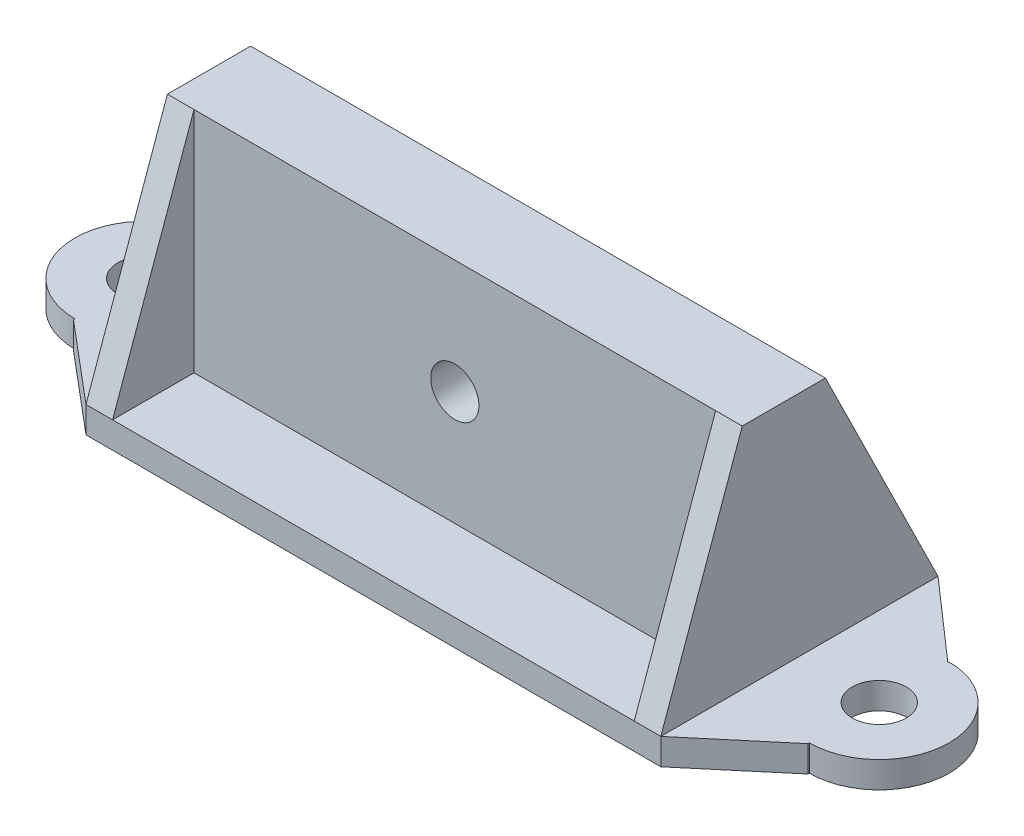
from build123d import *

# Parameters (mm, degrees)
CROQUIS3_W               = 75.27
CROQUIS3_H               = 32.91
SALIENTE_EXTRUIR1_DEPTH  = 3.82
SALIENTE_EXTRUIR2_DEPTH  = 3.84
SALIENTE_EXTRUIR3_DEPTH  = 3.84
CROQUIS8_W               = 82.95
CROQUIS8_H               = 15.57
SALIENTE_EXTRUIR5_DEPTH  = 3.8
CROQUIS9_W               = 82.95
CROQUIS9_H               = 24.43
SALIENTE_EXTRUIR7_DEPTH  = 3.8
CROQUIS10_W              = 82.95
CROQUIS10_H              = 8.18
SALIENTE_EXTRUIR9_DEPTH  = 33.8
CROQUIS11_R              = 3.475
CORTAR_EXTRUIR3_DEPTH    = 33.8
SALIENTE_EXTRUIR10_DEPTH = 3.84
SALIENTE_EXTRUIR11_DEPTH = 3.84
CROQUIS15_R              = 3.9
SALIENTE_EXTRUIR12_DEPTH = 3.8


with BuildPart() as part:
    # Croquis3 → Saliente-Extruir1 (new body)
    with BuildSketch(Plane.XY):
        Rectangle(CROQUIS3_W, CROQUIS3_H)
    extrude(amount=SALIENTE_EXTRUIR1_DEPTH)

    # Croquis4 → Saliente-Extruir2 (add)
    with BuildSketch(Plane(origin=(37.635, 0, 0), x_dir=(0, 0, -1), z_dir=(1, 0, 0))):
        Polygon((-3.82, -16.455), (0, -16.455), (0, 16.455), (-3.82, 16.455), (-15.57, -16.455), align=None)
    extrude(amount=SALIENTE_EXTRUIR2_DEPTH)

    # Croquis5 → Saliente-Extruir3 (add)
    with BuildSketch(Plane.ZY.offset(37.635)):
        Polygon((3.82, -16.455), (0, -16.455), (0, 16.455), (3.82, 16.455), (15.57, -16.455), align=None)
    extrude(amount=SALIENTE_EXTRUIR3_DEPTH)

    # Croquis8 → Saliente-Extruir5 (add)
    with BuildSketch(Plane(origin=(0, -16.455, 0), x_dir=(-1, 0, 0), z_dir=(0, -1, 0))):
        with Locations((0, -7.785)):
            Rectangle(CROQUIS8_W, CROQUIS8_H)
    extrude(amount=SALIENTE_EXTRUIR5_DEPTH)

    # Croquis9 → Saliente-Extruir7 (add)
    with BuildSketch(Plane.XZ.offset(20.255)):
        with Locations((0, -12.215)):
            Rectangle(CROQUIS9_W, CROQUIS9_H)
    extrude(amount=-SALIENTE_EXTRUIR7_DEPTH)

    # Croquis10 → Saliente-Extruir9 (add)
    with BuildSketch(Plane(origin=(0, 16.455, 0), x_dir=(1, 0, 0), z_dir=(0, 1, 0))):
        with Locations((0, 4.09)):
            Rectangle(CROQUIS10_W, CROQUIS10_H)
    extrude(amount=-SALIENTE_EXTRUIR9_DEPTH)

    # Croquis11 → Cortar-Extruir3 (cut)
    with BuildSketch(Plane.XY.offset(3.82)):
        Circle(CROQUIS11_R)
    extrude(amount=-CORTAR_EXTRUIR3_DEPTH, mode=Mode.SUBTRACT)

    # Croquis12 → Saliente-Extruir10 (add)
    with BuildSketch(Plane(origin=(41.475, 0, 0), x_dir=(0, 0, -1), z_dir=(1, 0, 0))):
        Polygon((8.18, 16.455), (24.43, -16.455), (8.18, -16.455), align=None)
    extrude(amount=-SALIENTE_EXTRUIR10_DEPTH)

    # Croquis14 → Saliente-Extruir11 (add)
    with BuildSketch(Plane.ZY.offset(41.475)):
        Polygon((-8.18, 16.455), (-8.18, -16.772028127), (-24.43, -16.455), align=None)
    extrude(amount=-SALIENTE_EXTRUIR11_DEPTH)

    # Croquis15 → Saliente-Extruir12 (add)
    # profile 1 of 2: a face of its own
    with BuildSketch(Plane.XZ.offset(20.255)):
        with BuildLine():
            Line((41.475, 15.57), (41.475, -24.43))
            Line((41.475, -24.43), (52.99576157, -14.32670597))
            Line((52.99576157, -14.32670597), (52.99576157, -14.522664239))
            ThreePointArc((52.99576157, -14.522664239), (63.088425809, -4.43), (52.99576157, 5.662664239))
            Line((52.99576157, 5.662664239), (52.99576157, 5.858622508))
            Line((52.99576157, 5.858622508), (41.475, 15.57))
        make_face()
        with Locations(Location((52.99576157, -4.43, 0), (0, 0, 270))):
            Circle(CROQUIS15_R, mode=Mode.SUBTRACT)
    # profile 2 of 2: a face of its own
    with BuildSketch(Plane.XZ.offset(20.255)):
        with BuildLine():
            Line((-52.99576157, 5.858622508), (-41.475, 15.57))
            Line((-41.475, 15.57), (-41.475, -24.43))
            Line((-41.475, -24.43), (-52.99576157, -14.32670597))
            Line((-52.99576157, -14.32670597), (-52.99576157, -14.522664239))
            ThreePointArc((-52.99576157, -14.522664239), (-63.088425809, -4.43), (-52.99576157, 5.662664239))
            Line((-52.99576157, 5.662664239), (-52.99576157, 5.858622508))
        make_face()
        with Locations(Location((-52.99576157, -4.43, 0), (0, 0, 270))):
            Circle(CROQUIS15_R, mode=Mode.SUBTRACT)
    extrude(amount=-SALIENTE_EXTRUIR12_DEPTH)


solid = part.part
